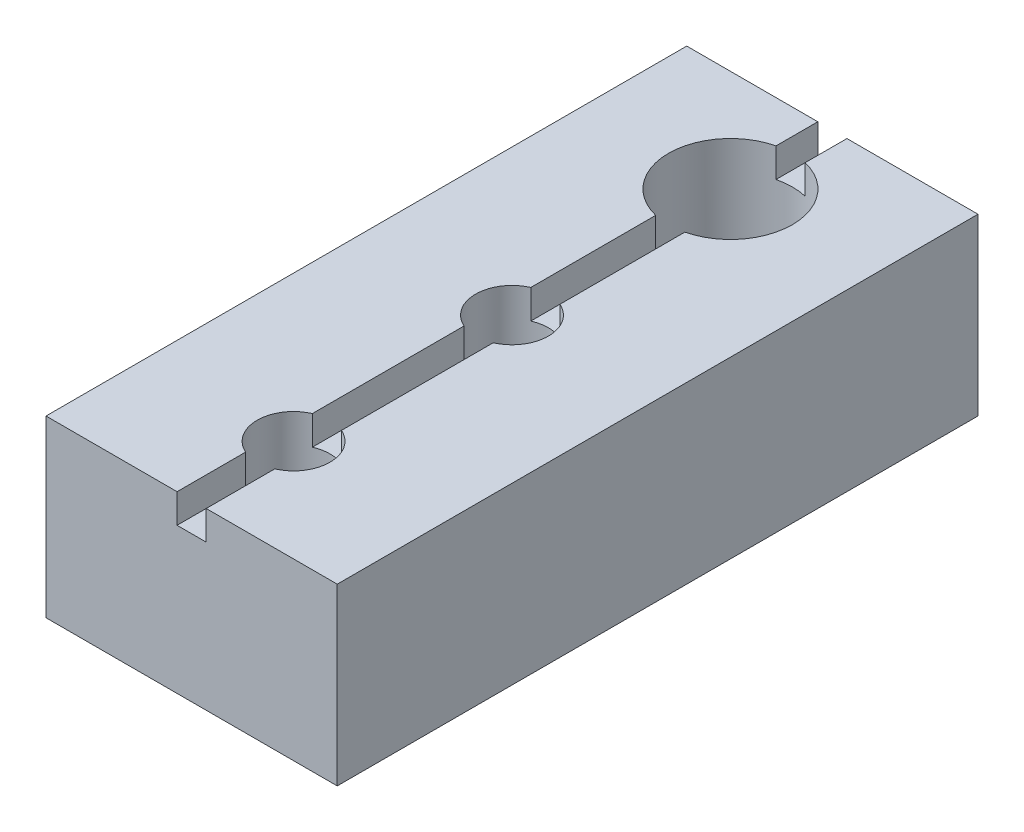
from build123d import *

# Parameters (mm, degrees)
SKETCH1_W              = 20
SKETCH1_H              = 12
BOSS_EXTRUDE1_DEPTH    = 22
M6X1_0_TAPPED_HOLE1_D  = 5
SKETCH7_W              = 2
SKETCH7_H              = 2
CUT_EXTRUDE2_DEPTH     = 46.519226707
M10X1_5_TAPPED_HOLE1_D = 8.5


with BuildPart() as part:
    # Sketch1 → Boss-Extrude1 (new, symmetric)
    with BuildSketch(Plane.XY):
        Rectangle(SKETCH1_W, SKETCH1_H)
    extrude(amount=BOSS_EXTRUDE1_DEPTH, both=True)

    # M6x1.0 Tapped Hole1 (through all)
    with Locations(Plane(origin=(0, 6, 0), x_dir=(1, 0, 0), z_dir=(0, 1, 0))):
        with Locations((0, -15), (0, 0), (0, 15)):
            Hole(M6X1_0_TAPPED_HOLE1_D / 2)

    # Sketch7 → Cut-Extrude2 (cut, through all)
    with BuildSketch(Plane(origin=(0, 0, -22), x_dir=(-1, 0, 0), z_dir=(0, 0, -1))):
        with Locations((0, 5)):
            Rectangle(SKETCH7_W, SKETCH7_H)
    extrude(amount=-CUT_EXTRUDE2_DEPTH, mode=Mode.SUBTRACT)

    # M10x1.5 Tapped Hole1 (through all)
    with Locations(Plane(origin=(0, 6, 0), x_dir=(1, 0, 0), z_dir=(0, 1, 0))):
        with Locations((0, 15)):
            Hole(M10X1_5_TAPPED_HOLE1_D / 2)


solid = part.part
